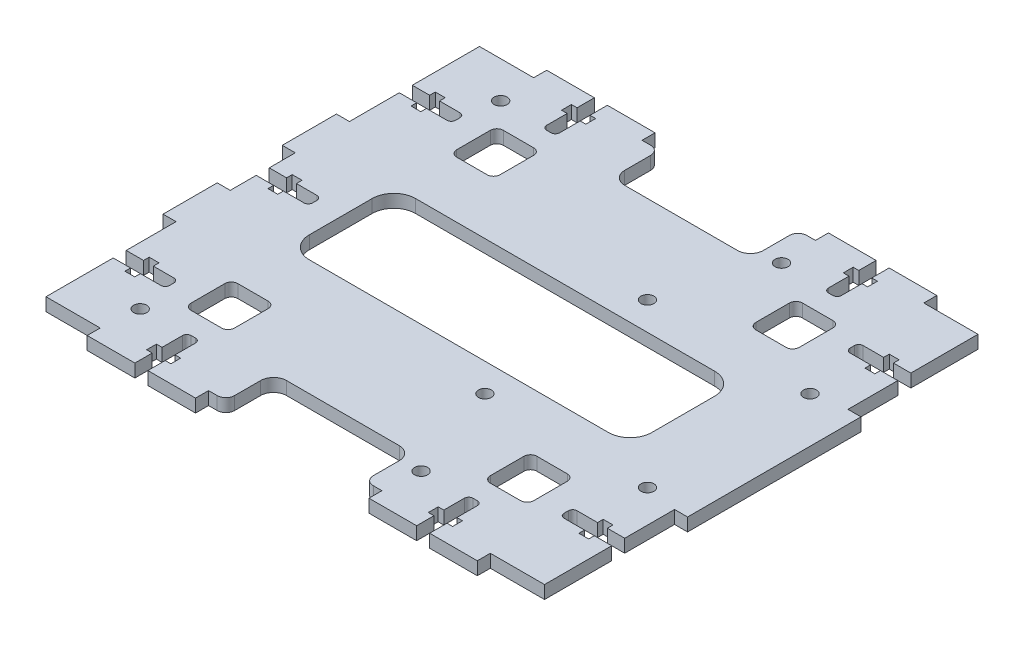
from build123d import *

# Parameters (mm, degrees)
ESBO_O1_W                  = 115
ESBO_O1_H                  = 100
RESSALTO_EXTRUS_O1_DEPTH   = 1.5
ESBO_O4_W                  = 3
ESBO_O4_H                  = 40
ESBO_O4_W_2                = 25
ESBO_O4_H_2                = 3
RESSALTO_EXTRUS_O2_DEPTH   = 3
CORTE_EXTRUS_O1_DEPTH      = 81.487576681
CORTE_EXTRUS_O4_DEPTH      = 81.487576681
CORTE_EXTRUS_O8_DEPTH      = 81.487576681
CORTE_EXTRUS_O8_DEPTH_BACK = 81.487576681
ESBO_O13_R                 = 1.5
CUT_EXTRUDE3_DEPTH         = 81.445633816
CUT_EXTRUDE3_DEPTH_BACK    = 81.445633816
CUT_EXTRUDE4_DEPTH         = 81.445633816
CUT_EXTRUDE4_DEPTH_BACK    = 81.445633816
CUT_EXTRUDE5_DEPTH         = 81.445633816
CUT_EXTRUDE5_DEPTH_BACK    = 81.445633816
FILLET1_R                  = 2
CUT_EXTRUDE6_DEPTH         = 81.445633816
CUT_EXTRUDE6_DEPTH_BACK    = 81.445633816
CUT_EXTRUDE7_DEPTH         = 81.487576681
CUT_EXTRUDE7_DEPTH_BACK    = 81.487576681
SKETCH8_R                  = 1.5


with BuildPart() as part:
    # Esboço1 → Ressalto-extrusão1 (new, symmetric)
    with BuildSketch(Plane(origin=(0, 0, 0), x_dir=(1, 0, 0), z_dir=(0, 1, 0))):
        Rectangle(ESBO_O1_W, ESBO_O1_H)
    extrude(amount=RESSALTO_EXTRUS_O1_DEPTH, both=True)

    # Esboço4 → Ressalto-extrusão2 (add, through all)
    with BuildSketch(Plane(origin=(0, 1.5, 0), x_dir=(1, 0, 0), z_dir=(0, 1, 0))):
        with Locations((-59, 0)):
            Rectangle(ESBO_O4_W, ESBO_O4_H)
        with Locations((-32.5, -51.5)):
            Rectangle(ESBO_O4_W_2, ESBO_O4_H_2)
        with Locations((59, 0)):
            Rectangle(ESBO_O4_W, ESBO_O4_H)
        with Locations((32.5, -51.5)):
            Rectangle(ESBO_O4_W_2, ESBO_O4_H_2)
        with Locations((32.5, 51.5)):
            Rectangle(ESBO_O4_W_2, ESBO_O4_H_2)
        with Locations((-32.5, 51.5)):
            Rectangle(ESBO_O4_W_2, ESBO_O4_H_2)
    extrude(amount=-RESSALTO_EXTRUS_O2_DEPTH)

    # Esboço2 → Corte-extrusão1 (cut, through all)
    with BuildSketch(Plane(origin=(0, 1.5, 0), x_dir=(1, 0, 0), z_dir=(0, 1, 0))):
        with BuildLine():
            Line((-34, -53), (-31, -53))
            Line((-31, -53), (-31, -49))
            Line((-31, -49), (-29.7, -49))
            Line((-29.7, -49), (-29.7, -46.73))
            Line((-29.7, -46.73), (-31, -46.73))
            Line((-31, -46.73), (-31, -42))
            ThreePointArc((-31, -42), (-31.292893219, -41.292893219), (-32, -41))
            Line((-32, -41), (-33, -41))
            ThreePointArc((-33, -41), (-33.707106781, -41.292893219), (-34, -42))
            Line((-34, -42), (-34, -46.73))
            Line((-34, -46.73), (-35.3, -46.73))
            Line((-35.3, -46.73), (-35.3, -49))
            Line((-35.3, -49), (-34, -49))
            Line((-34, -49), (-34, -53))
        make_face()
        with BuildLine():
            Line((31, -46.73), (31, -42))
            ThreePointArc((31, -42), (31.292893219, -41.292893219), (32, -41))
            Line((32, -41), (33, -41))
            ThreePointArc((33, -41), (33.707106781, -41.292893219), (34, -42))
            Line((34, -42), (34, -46.73))
            Line((34, -46.73), (35.3, -46.73))
            Line((35.3, -46.73), (35.3, -49))
            Line((35.3, -49), (34, -49))
            Line((34, -49), (34, -53))
            Line((34, -53), (31, -53))
            Line((31, -53), (31, -49))
            Line((31, -49), (29.7, -49))
            Line((29.7, -49), (29.7, -46.73))
            Line((29.7, -46.73), (31, -46.73))
        make_face()
        with BuildLine():
            Line((34, 53), (31, 53))
            Line((31, 53), (31, 49))
            Line((31, 49), (29.7, 49))
            Line((29.7, 49), (29.7, 46.73))
            Line((29.7, 46.73), (31, 46.73))
            Line((31, 46.73), (31, 42))
            ThreePointArc((31, 42), (31.292893219, 41.292893219), (32, 41))
            Line((32, 41), (33, 41))
            ThreePointArc((33, 41), (33.707106781, 41.292893219), (34, 42))
            Line((34, 42), (34, 46.73))
            Line((34, 46.73), (35.3, 46.73))
            Line((35.3, 46.73), (35.3, 49))
            Line((35.3, 49), (34, 49))
            Line((34, 49), (34, 53))
        make_face()
        with BuildLine():
            Line((-31, 46.73), (-31, 42))
            ThreePointArc((-31, 42), (-31.292893219, 41.292893219), (-32, 41))
            Line((-32, 41), (-33, 41))
            ThreePointArc((-33, 41), (-33.707106781, 41.292893219), (-34, 42))
            Line((-34, 42), (-34, 46.73))
            Line((-34, 46.73), (-35.3, 46.73))
            Line((-35.3, 46.73), (-35.3, 49))
            Line((-35.3, 49), (-34, 49))
            Line((-34, 49), (-34, 53))
            Line((-34, 53), (-31, 53))
            Line((-31, 53), (-31, 49))
            Line((-31, 49), (-29.7, 49))
            Line((-29.7, 49), (-29.7, 46.73))
            Line((-29.7, 46.73), (-31, 46.73))
        make_face()
    extrude(amount=-CORTE_EXTRUS_O1_DEPTH, mode=Mode.SUBTRACT)

    # Esboço7 → Corte-extrusão4 (cut, through all)
    with BuildSketch(Plane(origin=(0, 1.5, 0), x_dir=(1, 0, 0), z_dir=(0, 1, 0))):
        with BuildLine():
            Line((-57.5, -31.5), (-53.5, -31.5))
            Line((-53.5, -31.5), (-53.5, -30.2))
            Line((-53.5, -30.2), (-51.23, -30.2))
            Line((-51.23, -30.2), (-51.23, -31.5))
            Line((-51.23, -31.5), (-46.5, -31.5))
            ThreePointArc((-46.5, -31.5), (-45.792893219, -31.792893219), (-45.5, -32.5))
            Line((-45.5, -32.5), (-45.5, -33.5))
            ThreePointArc((-45.5, -33.5), (-45.792893219, -34.207106781), (-46.5, -34.5))
            Line((-46.5, -34.5), (-51.23, -34.5))
            Line((-51.23, -34.5), (-51.23, -35.8))
            Line((-51.23, -35.8), (-53.5, -35.8))
            Line((-53.5, -35.8), (-53.5, -34.5))
            Line((-53.5, -34.5), (-57.5, -34.5))
            Line((-57.5, -34.5), (-57.5, -31.5))
        make_face()
        with BuildLine():
            Line((53.5, -34.5), (53.5, -35.8))
            Line((53.5, -35.8), (51.23, -35.8))
            Line((51.23, -35.8), (51.23, -34.5))
            Line((51.23, -34.5), (46.5, -34.5))
            ThreePointArc((46.5, -34.5), (45.792893219, -34.207106781), (45.5, -33.5))
            Line((45.5, -33.5), (45.5, -32.5))
            ThreePointArc((45.5, -32.5), (45.792893219, -31.792893219), (46.5, -31.5))
            Line((46.5, -31.5), (51.23, -31.5))
            Line((51.23, -31.5), (51.23, -30.2))
            Line((51.23, -30.2), (53.5, -30.2))
            Line((53.5, -30.2), (53.5, -31.5))
            Line((53.5, -31.5), (57.5, -31.5))
            Line((57.5, -31.5), (57.5, -34.5))
            Line((57.5, -34.5), (53.5, -34.5))
        make_face()
        with BuildLine():
            Line((57.5, 31.5), (53.5, 31.5))
            Line((53.5, 31.5), (53.5, 30.2))
            Line((53.5, 30.2), (51.23, 30.2))
            Line((51.23, 30.2), (51.23, 31.5))
            Line((51.23, 31.5), (46.5, 31.5))
            ThreePointArc((46.5, 31.5), (45.792893219, 31.792893219), (45.5, 32.5))
            Line((45.5, 32.5), (45.5, 33.5))
            ThreePointArc((45.5, 33.5), (45.792893219, 34.207106781), (46.5, 34.5))
            Line((46.5, 34.5), (51.23, 34.5))
            Line((51.23, 34.5), (51.23, 35.8))
            Line((51.23, 35.8), (53.5, 35.8))
            Line((53.5, 35.8), (53.5, 34.5))
            Line((53.5, 34.5), (57.5, 34.5))
            Line((57.5, 34.5), (57.5, 31.5))
        make_face()
        with BuildLine():
            Line((-53.5, 34.5), (-53.5, 35.8))
            Line((-53.5, 35.8), (-51.23, 35.8))
            Line((-51.23, 35.8), (-51.23, 34.5))
            Line((-51.23, 34.5), (-46.5, 34.5))
            ThreePointArc((-46.5, 34.5), (-45.792893219, 34.207106781), (-45.5, 33.5))
            Line((-45.5, 33.5), (-45.5, 32.5))
            ThreePointArc((-45.5, 32.5), (-45.792893219, 31.792893219), (-46.5, 31.5))
            Line((-46.5, 31.5), (-51.23, 31.5))
            Line((-51.23, 31.5), (-51.23, 30.2))
            Line((-51.23, 30.2), (-53.5, 30.2))
            Line((-53.5, 30.2), (-53.5, 31.5))
            Line((-53.5, 31.5), (-57.5, 31.5))
            Line((-57.5, 31.5), (-57.5, 34.5))
            Line((-57.5, 34.5), (-53.5, 34.5))
        make_face()
    extrude(amount=-CORTE_EXTRUS_O4_DEPTH, mode=Mode.SUBTRACT)

    # Esboço13 → Corte-extrusão8 (cut, two sides: drawn at the far end of the back side and taken through both)
    with BuildSketch(Plane(origin=(0, -1.5, 0), x_dir=(-1, 0, 0), z_dir=(0, -1, 0)).offset(-CORTE_EXTRUS_O8_DEPTH_BACK)):
        with Locations(Location((-12.5, -18.75, 0), (0, 0, 90))):
            Circle(ESBO_O13_R)
        with Locations(Location((-50, -18.75, 0), (0, 0, 90))):
            Circle(ESBO_O13_R)
        with Locations(Location((-12.5, 18.75, 0), (0, 0, 90))):
            Circle(ESBO_O13_R)
        with Locations(Location((-50, 18.75, 0), (0, 0, 90))):
            Circle(ESBO_O13_R)
    extrude(amount=CORTE_EXTRUS_O8_DEPTH + CORTE_EXTRUS_O8_DEPTH_BACK, mode=Mode.SUBTRACT)

    # Sketch4 → Cut-Extrude3 (cut, two sides: drawn at the far end of the back side and taken through both)
    with BuildSketch(Plane(origin=(0, 0, 0), x_dir=(1, 0, 0), z_dir=(0, 1, 0)).offset(-CUT_EXTRUDE3_DEPTH_BACK)):
        with BuildLine():
            Line((-38, 36), (-31, 36))
            ThreePointArc((-31, 36), (-29.939339828, 35.560660172), (-29.5, 34.5))
            Line((-29.5, 34.5), (-29.5, 26.75))
            ThreePointArc((-29.5, 26.75), (-29.939339828, 25.689339828), (-31, 25.25))
            Line((-31, 25.25), (-38, 25.25))
            ThreePointArc((-38, 25.25), (-39.060660172, 25.689339828), (-39.5, 26.75))
            Line((-39.5, 26.75), (-39.5, 34.5))
            ThreePointArc((-39.5, 34.5), (-39.060660172, 35.560660172), (-38, 36))
        make_face()
        with BuildLine():
            Line((29.5, 34.5), (29.5, 26.75))
            ThreePointArc((29.5, 26.75), (29.939339828, 25.689339828), (31, 25.25))
            Line((31, 25.25), (38, 25.25))
            ThreePointArc((38, 25.25), (39.060660172, 25.689339828), (39.5, 26.75))
            Line((39.5, 26.75), (39.5, 34.5))
            ThreePointArc((39.5, 34.5), (39.060660172, 35.560660172), (38, 36))
            Line((38, 36), (31, 36))
            ThreePointArc((31, 36), (29.939339828, 35.560660172), (29.5, 34.5))
        make_face()
        with BuildLine():
            Line((38, -36), (31, -36))
            ThreePointArc((31, -36), (29.939339828, -35.560660172), (29.5, -34.5))
            Line((29.5, -34.5), (29.5, -26.75))
            ThreePointArc((29.5, -26.75), (29.939339828, -25.689339828), (31, -25.25))
            Line((31, -25.25), (38, -25.25))
            ThreePointArc((38, -25.25), (39.060660172, -25.689339828), (39.5, -26.75))
            Line((39.5, -26.75), (39.5, -34.5))
            ThreePointArc((39.5, -34.5), (39.060660172, -35.560660172), (38, -36))
        make_face()
        with BuildLine():
            Line((-29.5, -34.5), (-29.5, -26.75))
            ThreePointArc((-29.5, -26.75), (-29.939339828, -25.689339828), (-31, -25.25))
            Line((-31, -25.25), (-38, -25.25))
            ThreePointArc((-38, -25.25), (-39.060660172, -25.689339828), (-39.5, -26.75))
            Line((-39.5, -26.75), (-39.5, -34.5))
            ThreePointArc((-39.5, -34.5), (-39.060660172, -35.560660172), (-38, -36))
            Line((-38, -36), (-31, -36))
            ThreePointArc((-31, -36), (-29.939339828, -35.560660172), (-29.5, -34.5))
        make_face()
    extrude(amount=CUT_EXTRUDE3_DEPTH + CUT_EXTRUDE3_DEPTH_BACK, mode=Mode.SUBTRACT)

    # Sketch5 → Cut-Extrude4 (cut, two sides: drawn at the far end of the back side and taken through both)
    with BuildSketch(Plane(origin=(0, 0, 0), x_dir=(1, 0, 0), z_dir=(0, 1, 0)).offset(-CUT_EXTRUDE4_DEPTH_BACK)):
        with BuildLine():
            Line((-60.5, 7.5), (-57.5, 7.5))
            Line((-57.5, 7.5), (-57.5, 1.5))
            Line((-57.5, 1.5), (-53.5, 1.5))
            Line((-53.5, 1.5), (-53.5, 2.8))
            Line((-53.5, 2.8), (-51.23, 2.8))
            Line((-51.23, 2.8), (-51.23, 1.5))
            Line((-51.23, 1.5), (-46.5, 1.5))
            ThreePointArc((-46.5, 1.5), (-45.792893219, 1.207106781), (-45.5, 0.5))
            Line((-45.5, 0.5), (-45.5, -0.5))
            ThreePointArc((-45.5, -0.5), (-45.792893219, -1.207106781), (-46.5, -1.5))
            Line((-46.5, -1.5), (-51.23, -1.5))
            Line((-51.23, -1.5), (-51.23, -2.8))
            Line((-51.23, -2.8), (-53.5, -2.8))
            Line((-53.5, -2.8), (-53.5, -1.5))
            Line((-53.5, -1.5), (-57.5, -1.5))
            Line((-57.5, -1.5), (-57.5, -7.5))
            Line((-57.5, -7.5), (-60.5, -7.5))
            Line((-60.5, -7.5), (-60.5, 7.5))
        make_face()
    extrude(amount=CUT_EXTRUDE4_DEPTH + CUT_EXTRUDE4_DEPTH_BACK, mode=Mode.SUBTRACT)

    # Sketch6 → Cut-Extrude5 (cut, two sides: drawn at the far end of the back side and taken through both)
    with BuildSketch(Plane(origin=(0, 0, 0), x_dir=(1, 0, 0), z_dir=(0, 1, 0)).offset(-CUT_EXTRUDE5_DEPTH_BACK)):
        with BuildLine():
            Line((-16, -50), (16, -50))
            Line((16, -50), (16, -42))
            ThreePointArc((16, -42), (15.121320344, -39.878679656), (13, -39))
            Line((13, -39), (-13, -39))
            ThreePointArc((-13, -39), (-15.121320344, -39.878679656), (-16, -42))
            Line((-16, -42), (-16, -50))
        make_face()
        with BuildLine():
            Line((16, 50), (16, 42))
            ThreePointArc((16, 42), (15.121320344, 39.878679656), (13, 39))
            Line((13, 39), (-13, 39))
            ThreePointArc((-13, 39), (-15.121320344, 39.878679656), (-16, 42))
            Line((-16, 42), (-16, 50))
            Line((-16, 50), (16, 50))
        make_face()
    extrude(amount=CUT_EXTRUDE5_DEPTH + CUT_EXTRUDE5_DEPTH_BACK, mode=Mode.SUBTRACT)

    # Fillet1
    fillet1_edges = [part.edges().sort_by_distance(p)[0] for p in [
        (-16, 0, 50),
        (16, 0, 50),
        (-16, 0, -50),
        (16, 0, -50),
    ]]
    fillet(fillet1_edges, radius=FILLET1_R)

    # Sketch7 → Cut-Extrude6 (cut, two sides: drawn at the far end of the back side and taken through both)
    with BuildSketch(Plane(origin=(0, 0, 0), x_dir=(1, 0, 0), z_dir=(0, 1, 0)).offset(-CUT_EXTRUDE6_DEPTH_BACK)):
        with BuildLine():
            Line((-34.5, -12.25), (34.5, -12.25))
            ThreePointArc((34.5, -12.25), (38.035533906, -10.785533906), (39.5, -7.25))
            Line((39.5, -7.25), (39.5, 7.25))
            ThreePointArc((39.5, 7.25), (38.035533906, 10.785533906), (34.5, 12.25))
            Line((34.5, 12.25), (-34.5, 12.25))
            ThreePointArc((-34.5, 12.25), (-38.035533906, 10.785533906), (-39.5, 7.25))
            Line((-39.5, 7.25), (-39.5, -7.25))
            ThreePointArc((-39.5, -7.25), (-38.035533906, -10.785533906), (-34.5, -12.25))
        make_face()
    extrude(amount=CUT_EXTRUDE6_DEPTH + CUT_EXTRUDE6_DEPTH_BACK, mode=Mode.SUBTRACT)

    # Sketch8 → Cut-Extrude7 (cut, two sides: drawn at the far end of the back side and taken through both)
    with BuildSketch(Plane(origin=(0, 1.5, 0), x_dir=(1, 0, 0), z_dir=(0, 1, 0)).offset(-CUT_EXTRUDE7_DEPTH_BACK)):
        with Locations(Location((-44.2, -41.58, 0), (0, 0, 270))):
            Circle(SKETCH8_R)
        with Locations(Location((-44.2, 41.58, 0), (0, 0, 270))):
            Circle(SKETCH8_R)
        with Locations(Location((20.6, -41.58, 0), (0, 0, 270))):
            Circle(SKETCH8_R)
        with Locations(Location((20.6, 41.58, 0), (0, 0, 270))):
            Circle(SKETCH8_R)
    extrude(amount=CUT_EXTRUDE7_DEPTH + CUT_EXTRUDE7_DEPTH_BACK, mode=Mode.SUBTRACT)


solid = part.part
